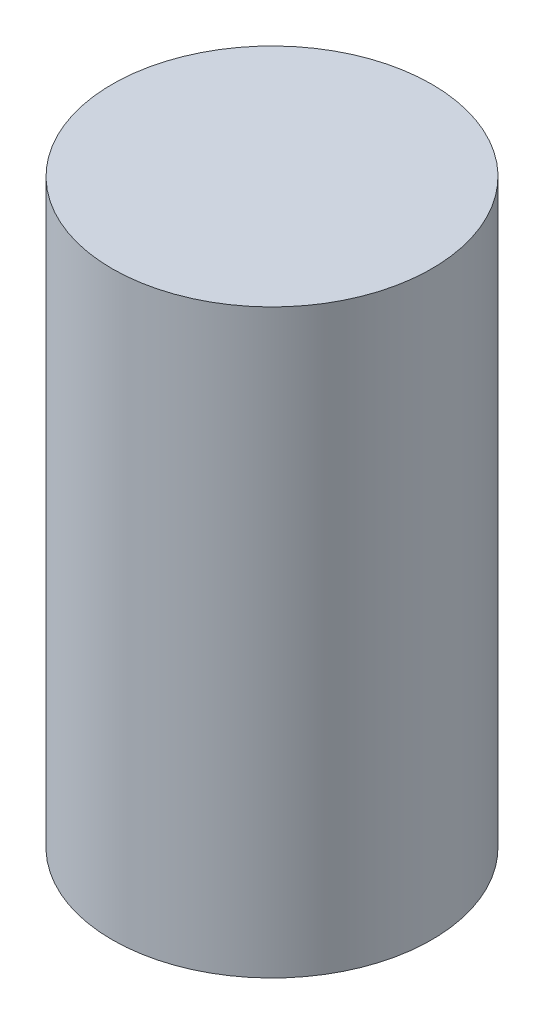
from build123d import *

# Parameters (mm, degrees)
SKETCH_1_R      = 33
EXTRUDE_1_DEPTH = 120


with BuildPart() as part:
    # Эскиз1 → Бобышка-Вытянуть1 (new body)
    with BuildSketch(Plane(origin=(0, 0, 0), x_dir=(1, 0, 0), z_dir=(0, 1, 0))):
        with Locations(Location((0, 0, 0), (0, 0, 270))):
            Circle(SKETCH_1_R)
    extrude(amount=EXTRUDE_1_DEPTH)


solid = part.part
